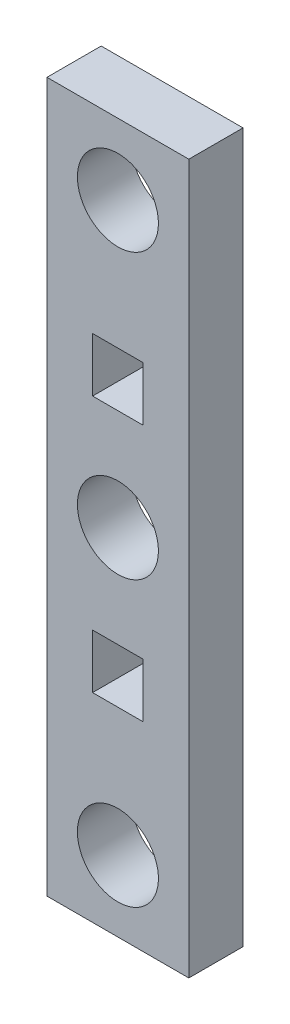
from build123d import *

# Parameters (mm, degrees)
MODEL_W             = 14
MODEL_H             = 70
MODEL_R             = 4
MODEL_W_2           = 5
MODEL_H_2           = 5.35
BOSS_EXTRUDE1_DEPTH = 5.35


with BuildPart() as part:
    # Model → Boss-Extrude1 (new body)
    with BuildSketch(Plane.XY):
        with Locations((7, 35)):
            Rectangle(MODEL_W, MODEL_H)
        with Locations((7, 63)):
            Circle(MODEL_R, mode=Mode.SUBTRACT)
        with Locations(Location((7, 7, 0), (0, 0, 180))):
            Circle(MODEL_R, mode=Mode.SUBTRACT)
        with Locations((7, 35)):
            Circle(MODEL_R, mode=Mode.SUBTRACT)
        with Locations((7, 47.675)):
            Rectangle(MODEL_W_2, MODEL_H_2, mode=Mode.SUBTRACT)
        with Locations((7, 22.325)):
            Rectangle(MODEL_W_2, MODEL_H_2, mode=Mode.SUBTRACT)
    extrude(amount=BOSS_EXTRUDE1_DEPTH)


solid = part.part
